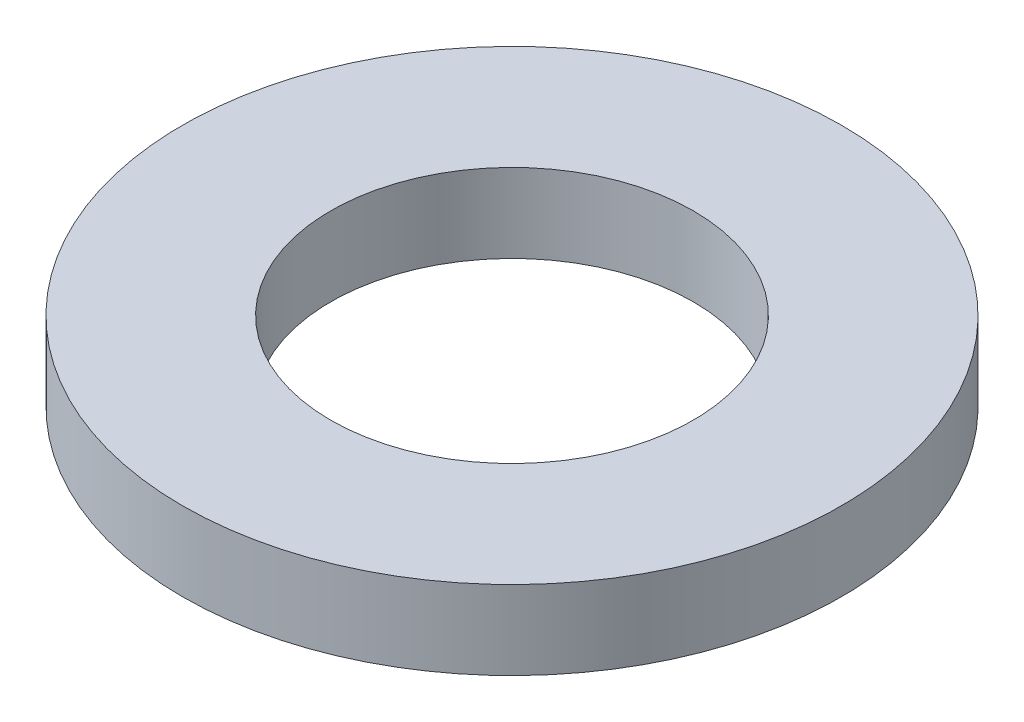
from build123d import *

# Parameters (mm, degrees)
SKETCH1_R           = 2.6543
SKETCH1_R_2         = 1.4605
BOSS_EXTRUDE1_DEPTH = 0.635


with BuildPart() as part:
    # Sketch1 → Boss-Extrude1 (new body)
    with BuildSketch(Plane(origin=(0, 0, 0), x_dir=(1, 0, 0), z_dir=(0, 1, 0))):
        with Locations(Location((0, 0, 0), (0, 0, 270))):
            Circle(SKETCH1_R)
        with Locations(Location((0, 0, 0), (0, 0, 270))):
            Circle(SKETCH1_R_2, mode=Mode.SUBTRACT)
    extrude(amount=BOSS_EXTRUDE1_DEPTH)


solid = part.part
